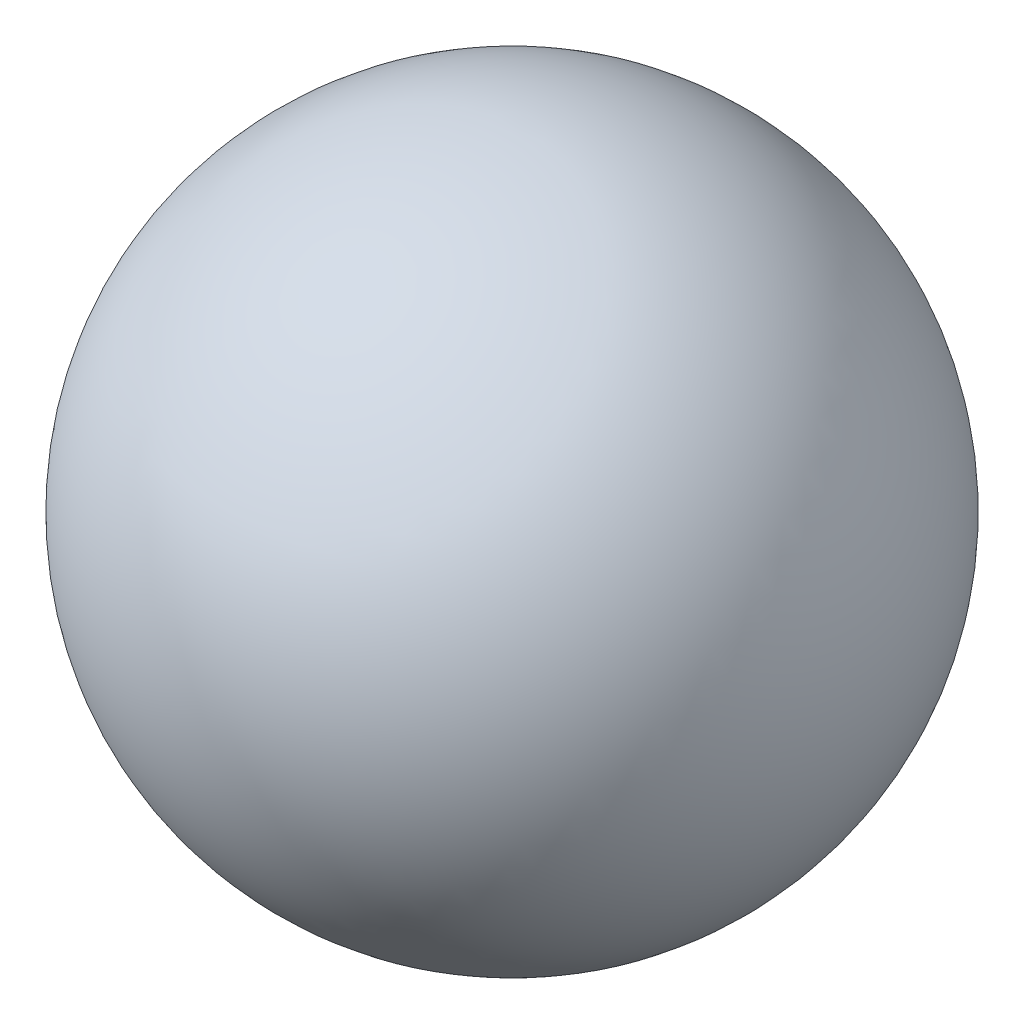
from build123d import *


with BuildPart() as part:
    # Sketch1 → Revolve2 (revolve)
    with BuildSketch(Plane.XY):
        with BuildLine():
            Line((0, 31.25), (0, -31.25))
            ThreePointArc((0, -31.25), (31.25, 0), (0, 31.25))
        make_face()
    revolve(axis=Axis((0, 0, 0), (0, -1, 0)))


solid = part.part
